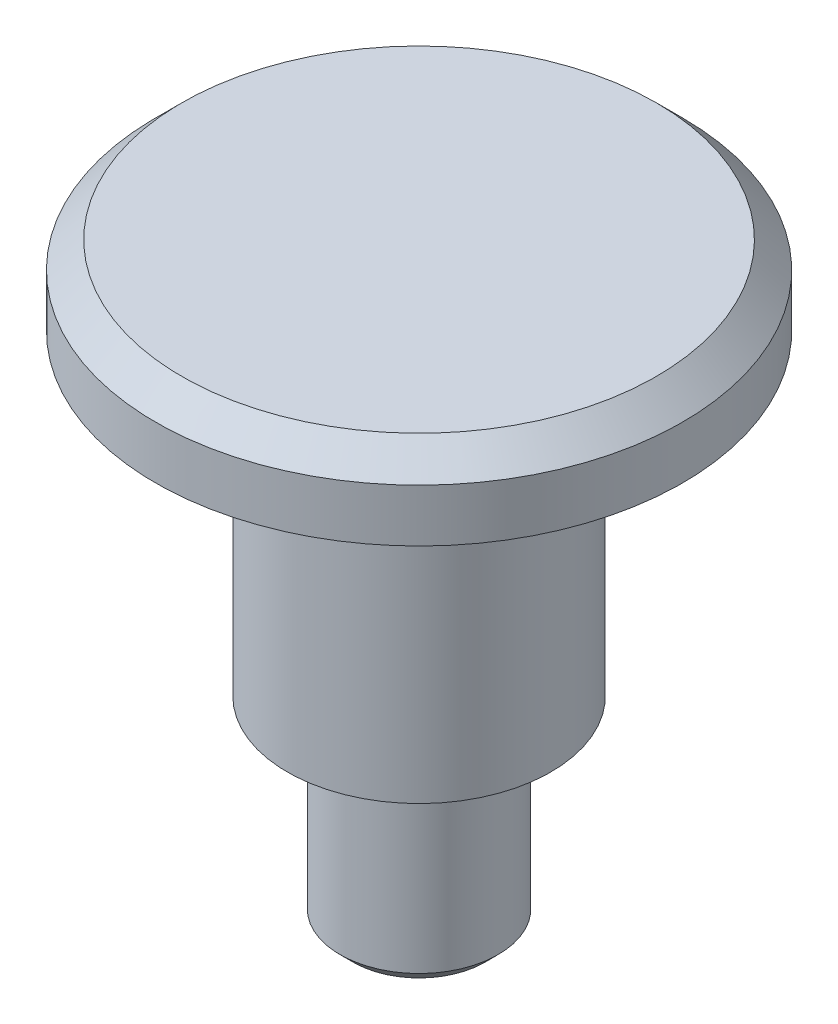
from build123d import *


with BuildPart() as part:
    # Esquisse1 → Base-Révolution (revolve)
    with BuildSketch(Plane.XY, mode=Mode.PRIVATE) as base_r_volution_sk:
        with BuildLine():
            Line((0, 0), (2.5, 0))
            Line((2.5, 0), (3, 0.5))
            Line((3, 0.5), (3, 7.5))
            ThreePointArc((3, 7.5), (3.3, 7.8), (3.6, 7.5))
            Line((3.6, 7.5), (5, 7.5))
            Line((5, 7.5), (5, 19.5))
            ThreePointArc((5, 19.5), (5.3, 19.8), (5.6, 19.5))
            Line((5.6, 19.5), (10, 19.5))
            Line((10, 19.5), (10, 21.5))
            Line((10, 21.5), (9, 22.5))
            Line((9, 22.5), (0, 22.5))
            Line((0, 22.5), (0, 0))
        make_face()
    revolve(base_r_volution_sk.sketch.rotate(Axis((0, 0, 0), (0, 1, 0)), 90), axis=Axis((0, 0, 0), (0, 1, 0)))


solid = part.part
